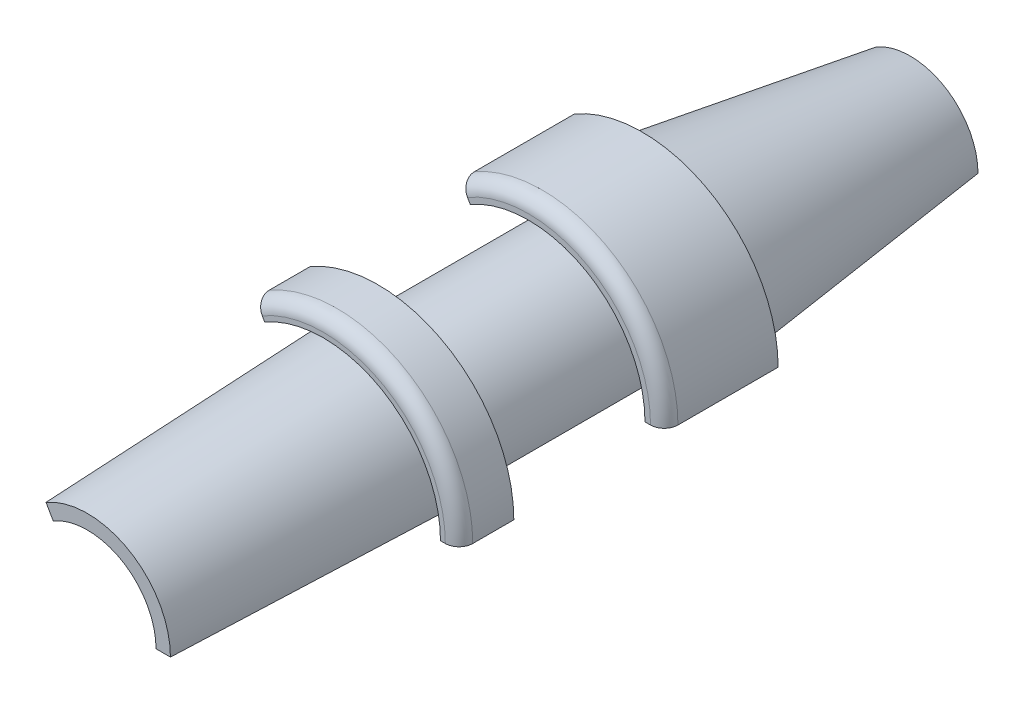
from build123d import *

# Parameters (mm, degrees)
REVOLVE_1_ANGLE     = 120
SKETCH_3_R          = 2.5
CUT_EXTRUDE_1_DEPTH = 1.5
FILLET_1_R          = 0.5


with BuildPart() as part:
    # 스케치2 → 회전1 (revolve)
    with BuildSketch(Plane(origin=(0, 0, 0), x_dir=(1, 0, 0), z_dir=(0, 1, 0))):
        Polygon((3.025, -30), (2.025, -30), (2.025, -6), (1.975, -5.95), (1.975, -5.05), (2.025, -5), (2.025, 0), (2.471154323, 0), (3.896197522, -9.284948012), (4.95, -9.76632184), (4.95, -13.919413001), (4.247678793, -13.919413001), (3.896197522, -11.490595407), (3.114172222, -11.490595407), (3.114172222, -18.601840787), (4.95, -19.404070604), (4.95, -21.401570634), (4.273015674, -21.401570634), (4.095786722, -20.253069256), (3.446467915, -20), align=None)
    revolve(axis=Axis((0, 0, 0), (0, 0, 1)), revolution_arc=REVOLVE_1_ANGLE)

    # 스케치3 → 컷-돌출1 (cut)
    with BuildSketch(Plane.XY.offset(30)):
        Circle(SKETCH_3_R)
    extrude(amount=-CUT_EXTRUDE_1_DEPTH, mode=Mode.SUBTRACT)

    # 필렛1
    fillet_1_edges = [part.edges().sort_by_distance(p)[0] for p in [
        (2.475, 4.286825749, 13.919413001),
        (2.475, 4.286825749, 21.401570634),
    ]]
    fillet(fillet_1_edges, radius=FILLET_1_R)


solid = part.part
